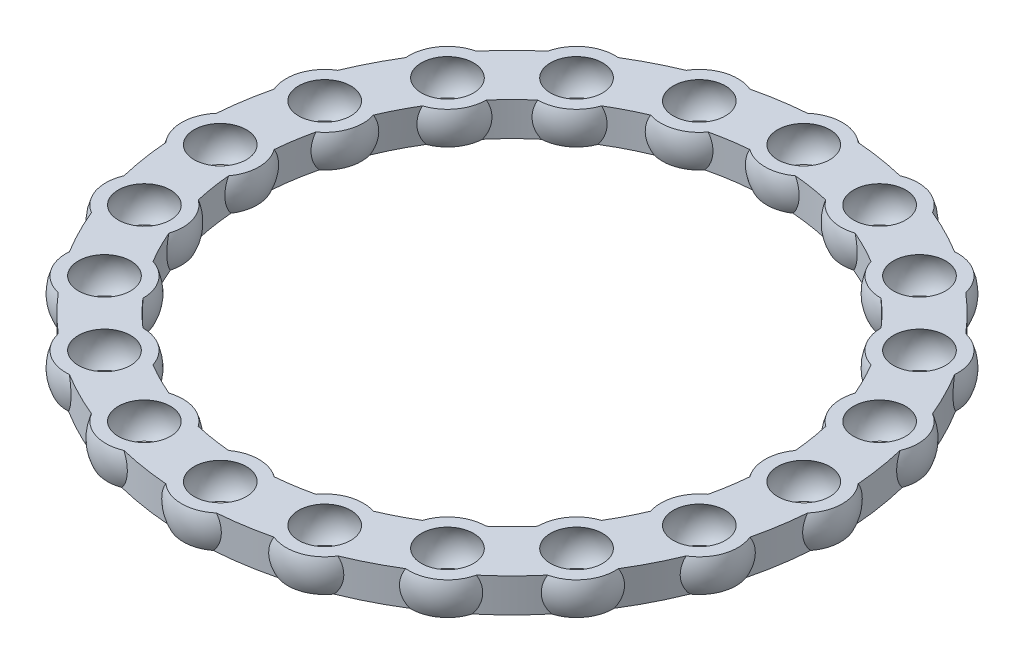
from build123d import *

# Parameters (mm, degrees)
BOSS_EXTRUDE1_DEPTH      = 2
BOSS_EXTRUDE1_DEPTH_BACK = 2.5
SKETCH1_R                = 42.75
SKETCH1_R_2              = 34.75
CIRPATTERN1_COUNT        = 20
CUT_EXTRUDE1_DEPTH       = 63.820179879
CUT_EXTRUDE1_DEPTH_BACK  = 63.820179879
SKETCH3_W                = 96.37623681
SKETCH3_H                = 4.351649471
SKETCH3_W_2              = 100.08793783
SKETCH3_H_2              = 8.178319703
CIRPATTERN2_COUNT        = 20


with BuildPart() as part:
    # Sketch1 → Boss-Extrude1 (new, two sides: drawn at the far end of the back side and taken through both)
    with BuildSketch(Plane(origin=(0, 0, 0), x_dir=(1, 0, 0), z_dir=(0, 1, 0)).offset(-BOSS_EXTRUDE1_DEPTH_BACK)):
        with Locations(Location((0, 0, 0), (0, 0, 270))):
            Circle(SKETCH1_R)
        with Locations(Location((0, 0, 0), (0, 0, 270))):
            Circle(SKETCH1_R_2, mode=Mode.SUBTRACT)
    extrude(amount=BOSS_EXTRUDE1_DEPTH + BOSS_EXTRUDE1_DEPTH_BACK)

    # Sketch2 → Revolve1 (revolve)
    with BuildSketch(Plane(origin=(0, 0, 0), x_dir=(1, 0, 0), z_dir=(0, 1, 0))):
        with BuildLine():
            Line((-5.5, 38.75), (5.5, 38.75))
            ThreePointArc((5.5, 38.75), (0, 44.25), (-5.5, 38.75))
        make_face()
    revolve1 = revolve(axis=Axis((-5.5, 0, -38.75), (1, 0, 0)))

    # CirPattern1: Revolve1 ×20 about axis
    cirpattern1_axis = Axis((0, 0, 0), (0, 1, 0))
    for i in range(1, CIRPATTERN1_COUNT):
        add(revolve1.rotate(cirpattern1_axis, i * 360 / CIRPATTERN1_COUNT))

    # Sketch3 → Cut-Extrude1 (cut, two sides: drawn at the far end of the back side and taken through both)
    with BuildSketch(Plane.XY.offset(-CUT_EXTRUDE1_DEPTH_BACK)):
        with Locations((-1.281130539, 4.175824735)):
            Rectangle(SKETCH3_W, SKETCH3_H)
        with Locations((0.574719971, -6.589159852)):
            Rectangle(SKETCH3_W_2, SKETCH3_H_2)
    extrude(amount=CUT_EXTRUDE1_DEPTH + CUT_EXTRUDE1_DEPTH_BACK, mode=Mode.SUBTRACT)

    # Sketch4 → Cut-Revolve1 (revolve, cut)
    with BuildSketch(Plane(origin=(0, 0, 0), x_dir=(1, 0, 0), z_dir=(0, 1, 0))):
        with BuildLine():
            Line((-4, 38.75), (4, 38.75))
            ThreePointArc((4, 38.75), (0, 42.75), (-4, 38.75))
        make_face()
    cut_revolve1 = revolve(axis=Axis((-4, 0, -38.75), (1, 0, 0)), mode=Mode.SUBTRACT)

    # CirPattern2: Cut-Revolve1 ×20 about axis
    cirpattern2_axis = Axis((0, 0, 0), (0, 1, 0))
    for i in range(1, CIRPATTERN2_COUNT):
        add(cut_revolve1.rotate(cirpattern2_axis, i * 360 / CIRPATTERN2_COUNT), mode=Mode.SUBTRACT)


solid = part.part
